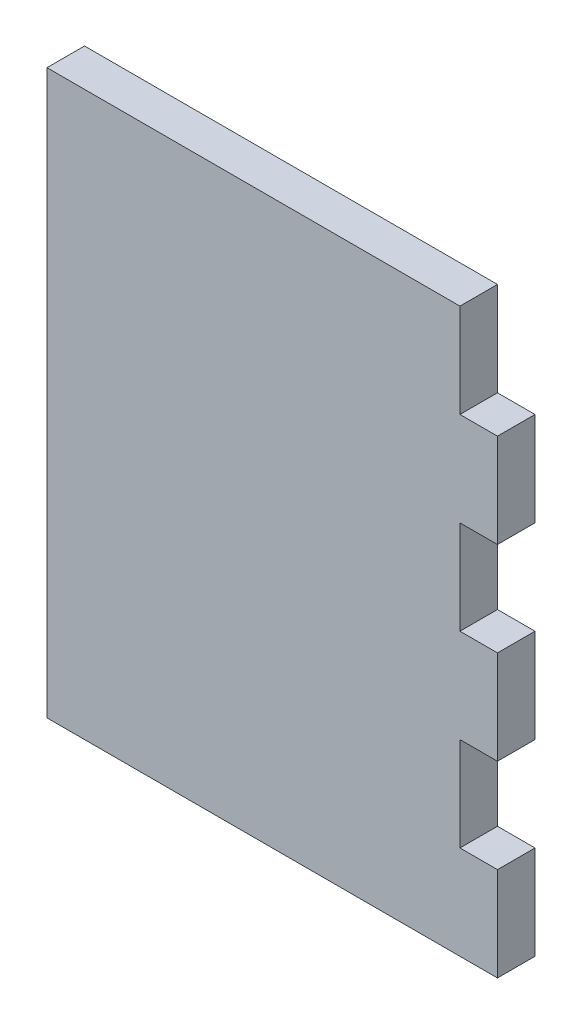
from build123d import *

# Parameters (mm, degrees)
EXTRUDE_1_DEPTH = 5


with BuildPart() as part:
    # Эскиз2 → Бобышка-Вытянуть1 (new body)
    with BuildSketch(Plane.XY):
        Polygon((0, 0), (60, 0), (60, 12.5), (55, 12.5), (55, 25), (60, 25), (60, 37.5), (55, 37.5), (55, 50), (60, 50), (60, 62.5), (55, 62.5), (55, 75), (0, 75), align=None)
    extrude(amount=EXTRUDE_1_DEPTH)


solid = part.part
